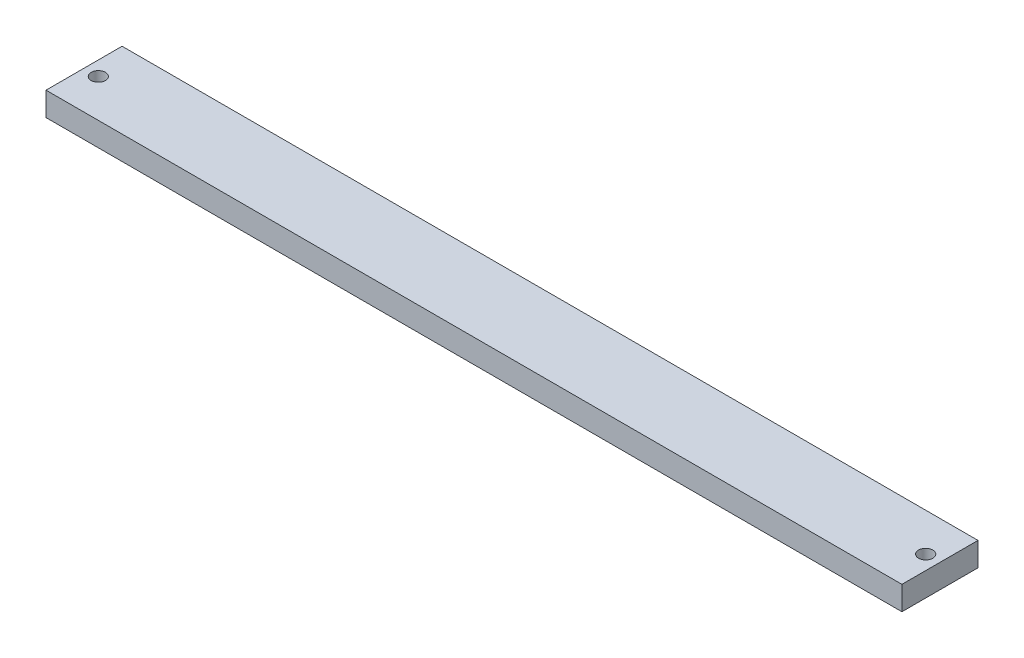
from build123d import *

# Parameters (mm, degrees)
CROQUIS1_W              = 180
CROQUIS1_H              = 16
SALIENTE_EXTRUIR1_DEPTH = 5
CROQUIS2_R              = 1.5
CORTAR_EXTRUIR1_DEPTH   = 91.493093659


with BuildPart() as part:
    # Croquis1 → Saliente-Extruir1 (new body)
    with BuildSketch(Plane(origin=(0, 0, 0), x_dir=(1, 0, 0), z_dir=(0, 1, 0))):
        Rectangle(CROQUIS1_W, CROQUIS1_H)
    extrude(amount=SALIENTE_EXTRUIR1_DEPTH)

    # Croquis2 → Cortar-Extruir1 (cut, through all)
    with BuildSketch(Plane.XZ):
        with Locations(Location((-87, 0, 0), (0, 0, 270))):
            Circle(CROQUIS2_R)
    cortar_extruir1 = extrude(amount=-CORTAR_EXTRUIR1_DEPTH, mode=Mode.SUBTRACT)

    # Simetría1: Cortar-Extruir1 across plane
    add(cortar_extruir1.mirror(Plane(origin=(0, 0, 0), x_dir=(0, 0, 1), z_dir=(1, 0, 0))), mode=Mode.SUBTRACT)


solid = part.part
